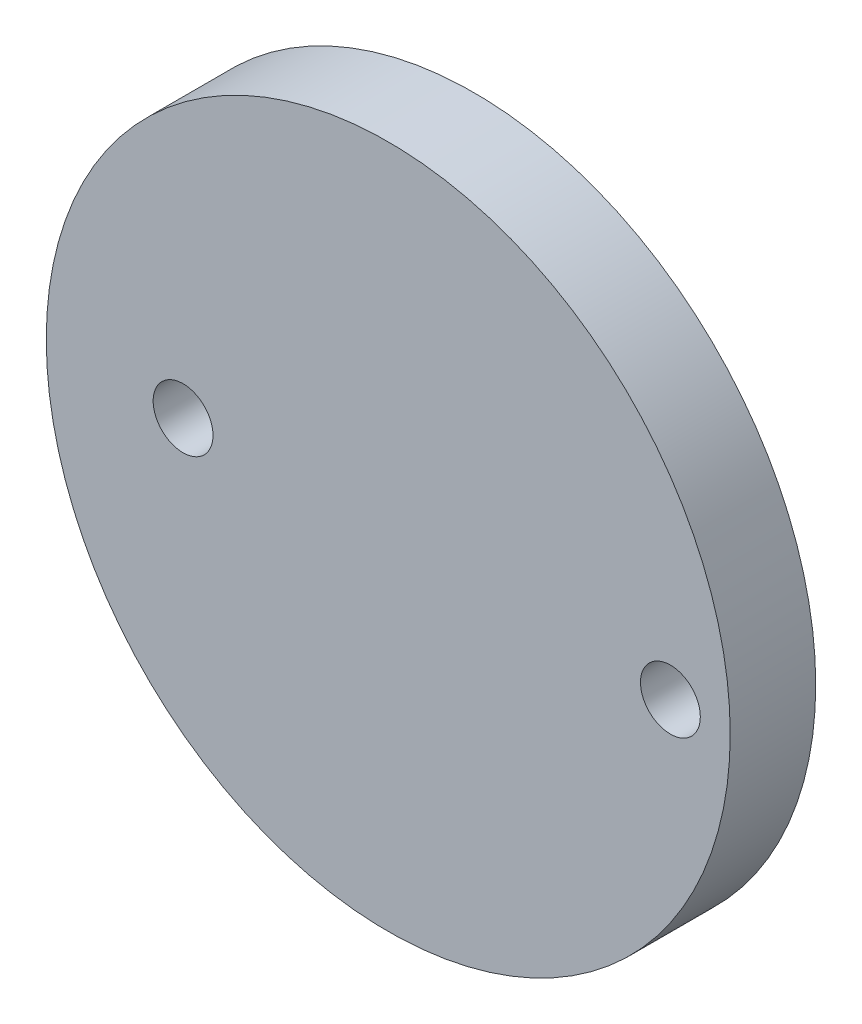
from build123d import *

# Parameters (mm, degrees)
SKETCH1_R           = 20
BOSS_EXTRUDE1_DEPTH = 5
SKETCH2_R           = 1.75
CUT_EXTRUDE1_DEPTH  = 29.722813233


with BuildPart() as part:
    # Sketch1 → Boss-Extrude1 (new body)
    with BuildSketch(Plane.XY):
        Circle(SKETCH1_R)
    extrude(amount=BOSS_EXTRUDE1_DEPTH)

    # Sketch2 → Cut-Extrude1 (cut, through all)
    with BuildSketch(Plane.XY.offset(5)):
        with Locations((16.5, 0)):
            Circle(SKETCH2_R)
        with Locations((-12, 0)):
            Circle(SKETCH2_R)
    extrude(amount=-CUT_EXTRUDE1_DEPTH, mode=Mode.SUBTRACT)


solid = part.part
